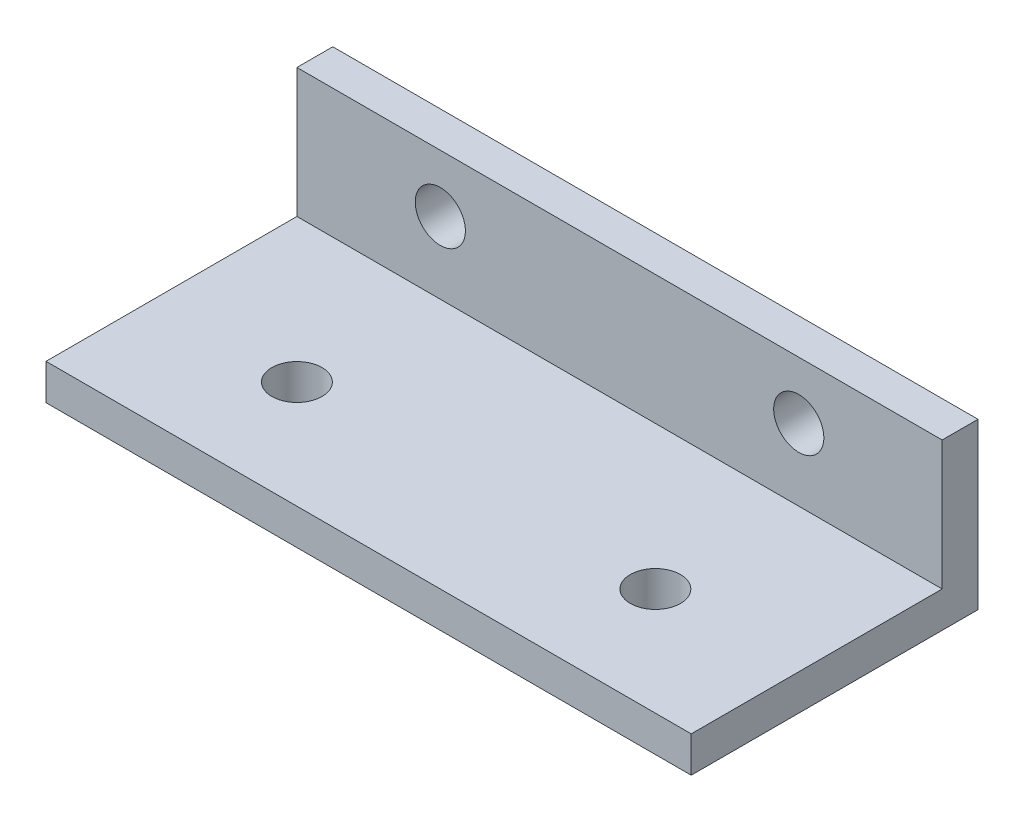
from build123d import *

# Parameters (mm, degrees)
SKETCH2_W             = 90
SKETCH2_H             = 23
BOSS_EXTRUDE2_DEPTH   = 5
SKETCH4_W             = 90
SKETCH4_H             = 5
BOSS_EXTRUDE3_DEPTH   = 35
M8X1_0_TAPPED_HOLE1_D = 7
M8X1_0_TAPPED_HOLE2_D = 7


with BuildPart() as part:
    # Sketch2 → Boss-Extrude2 (new body)
    with BuildSketch(Plane.XY):
        with Locations((0, -11.5)):
            Rectangle(SKETCH2_W, SKETCH2_H)
    extrude(amount=BOSS_EXTRUDE2_DEPTH)

    # Sketch4 → Boss-Extrude3 (add)
    with BuildSketch(Plane.XY.offset(5)):
        with Locations((0, -20.5)):
            Rectangle(SKETCH4_W, SKETCH4_H)
    extrude(amount=BOSS_EXTRUDE3_DEPTH)

    # M8x1.0 Tapped Hole1 (through all)
    with Locations(Plane.XY.offset(5)):
        with Locations((-25, -8), (25, -8)):
            Hole(M8X1_0_TAPPED_HOLE1_D / 2)

    # M8x1.0 Tapped Hole2 (through all)
    with Locations(Plane(origin=(0, -18, 0), x_dir=(1, 0, 0), z_dir=(0, 1, 0))):
        with Locations((-25, -25), (25, -25)):
            Hole(M8X1_0_TAPPED_HOLE2_D / 2)


solid = part.part
